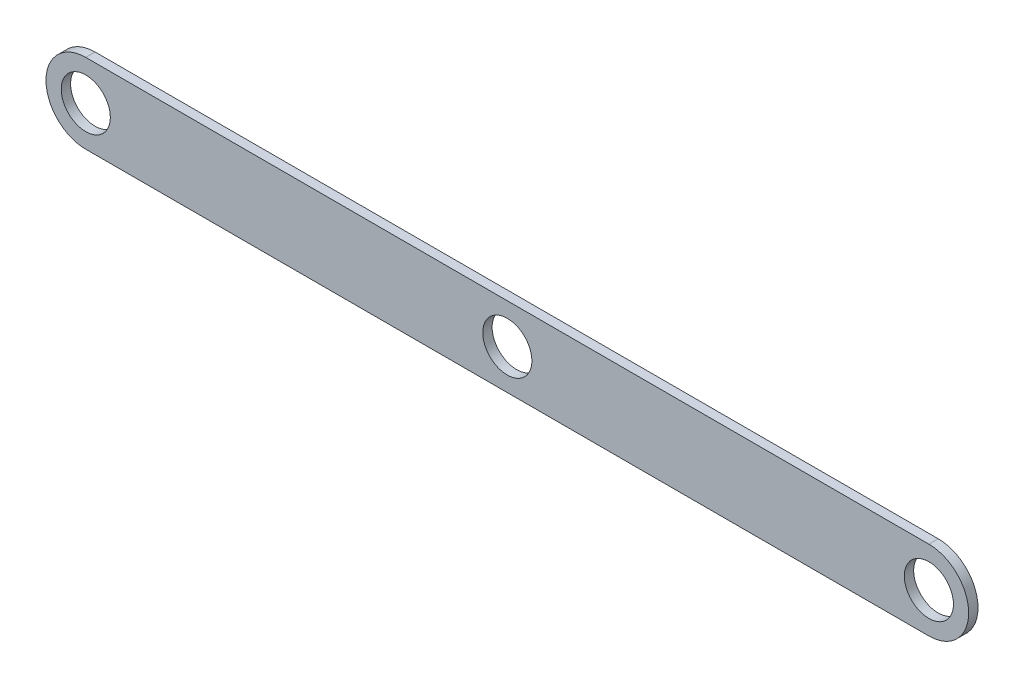
from build123d import *

# Parameters (mm, degrees)
SKIZZE2_R                       = 5.25
AUFSATZ_LINEAR_AUSTRAGEN1_DEPTH = 2


with BuildPart() as part:
    # Skizze2 → Aufsatz-Linear austragen1 (new body)
    with BuildSketch(Plane.XY):
        with BuildLine():
            Line((-90.1, 8.5), (90.1, 8.5))
            ThreePointArc((90.1, 8.5), (98.6, 0), (90.1, -8.5))
            Line((90.1, -8.5), (-90.1, -8.5))
            ThreePointArc((-90.1, -8.5), (-98.6, 0), (-90.1, 8.5))
        make_face()
        with Locations((-90.1, 0)):
            Circle(SKIZZE2_R, mode=Mode.SUBTRACT)
        with Locations((90.1, 0)):
            Circle(SKIZZE2_R, mode=Mode.SUBTRACT)
        Circle(SKIZZE2_R, mode=Mode.SUBTRACT)
    extrude(amount=AUFSATZ_LINEAR_AUSTRAGEN1_DEPTH)


solid = part.part
